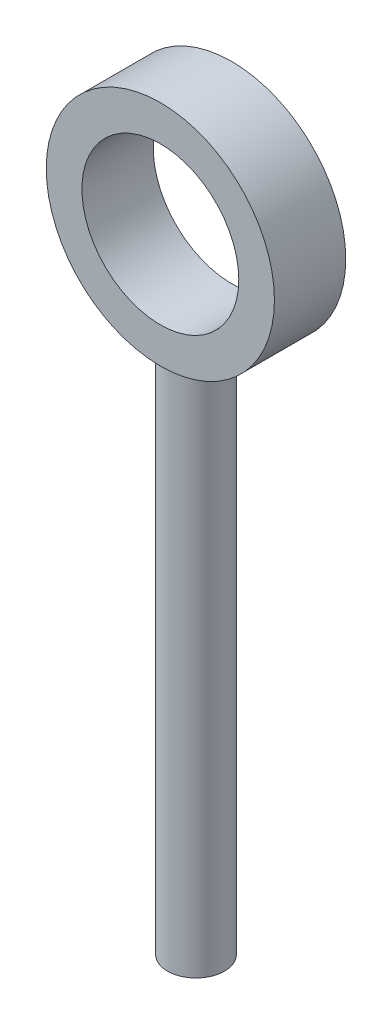
from build123d import *

# Parameters (mm, degrees)
SKETCH_1_R           = 8
SKETCH_1_R_2         = 5.5
EXTRUDE_1_DEPTH      = 2.5
EXTRUDE_2_REACH      = 55.659
EXTRUDE_2_END_RADIUS = 8
SKETCH_3_R           = 2


with BuildPart() as part:
    # 草图1 → 凸台-拉伸1 (new, symmetric)
    with BuildSketch(Plane.XY):
        Circle(SKETCH_1_R)
        Circle(SKETCH_1_R_2, mode=Mode.SUBTRACT)
    extrude(amount=EXTRUDE_1_DEPTH, both=True)

    # 凸台-拉伸2: up to this cylinder (the profile starts outside it)
    extrude_2_end = Plane(origin=(0, 0, 0), z_dir=(0, 0, -1)) * Cylinder(EXTRUDE_2_END_RADIUS, 128.318, mode=Mode.PRIVATE)
    # 草图3 → 凸台-拉伸2 (add, up to the surface)
    with BuildSketch(Plane(origin=(0, -45, 0), x_dir=(1, 0, 0), z_dir=(0, 1, 0)), mode=Mode.PRIVATE) as extrude_2_sk1:
        with Locations(Location((0, 0, 0), (0, 0, 90))):
            Circle(SKETCH_3_R)
    extrude_2_tool1 = extrude(extrude_2_sk1.sketch, amount=EXTRUDE_2_REACH, mode=Mode.PRIVATE) - extrude_2_end
    add(extrude_2_tool1.solids().sort_by_distance((0, -45, 0))[0])


solid = part.part
